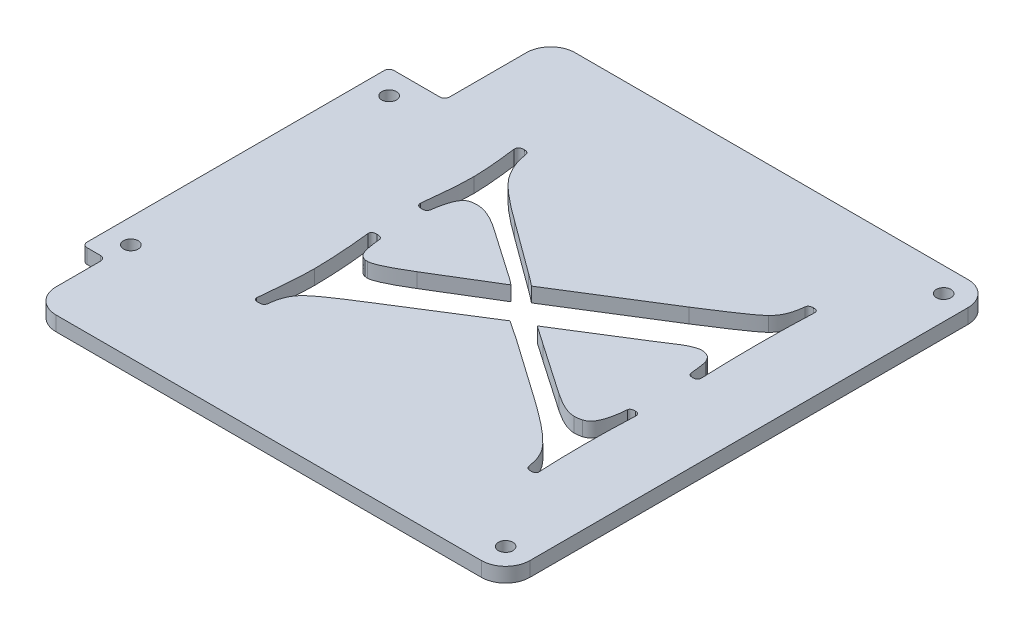
from build123d import *

# Parameters (mm, degrees)
BOSS_EXTRUDE1_DEPTH = 3
FILLET3_R           = 5
FILLET2_R           = 1
SKETCH2_R           = 1.5
CUT_EXTRUDE1_DEPTH  = 3
CUT_EXTRUDE2_DEPTH  = 3


with BuildPart() as part:
    # Sketch1 → Boss-Extrude1 (new body)
    with BuildSketch(Plane(origin=(0, 23, 0), x_dir=(1, 0, 0), z_dir=(0, 1, 0))):
        Polygon((98.305417602, 50), (98.305417602, 28.219474586), (86.879951937, 28.219474586), (86.879951937, -34.842217343), (91.659783805, -34.842217343), (91.659783805, -50), (97.650210801, -50), (189.045787513, -50), (189.045787513, 50), align=None)
    extrude(amount=BOSS_EXTRUDE1_DEPTH)

    # Fillet3
    fillet3_edges = [part.edges().sort_by_distance(p)[0] for p in [
        (189.045787513, 24.5, 50),
        (91.659783805, 24.5, 50),
        (98.305417602, 24.5, -50),
        (189.045787513, 24.5, -50),
    ]]
    fillet(fillet3_edges, radius=FILLET3_R)

    # Fillet2
    fillet2_edges = [part.edges().sort_by_distance(p)[0] for p in [
        (91.659783805, 24.5, 34.842217343),
        (86.879951937, 24.5, 34.842217343),
        (86.879951937, 24.5, -28.219474586),
        (98.305417602, 24.5, -28.219474586),
    ]]
    fillet(fillet2_edges, radius=FILLET2_R)

    # Sketch2 → Cut-Extrude1 (cut)
    with BuildSketch(Plane(origin=(0, 23, 0), x_dir=(1, 0, 0), z_dir=(0, 1, 0))):
        with Locations(Location((184.045787513, -45, 0), (0, 0, 90))):
            Circle(SKETCH2_R)
        with Locations(Location((91.879951937, -29.842217343, 0), (0, 0, 90))):
            Circle(SKETCH2_R)
        with Locations(Location((91.879951937, 23.219474586, 0), (0, 0, 90))):
            Circle(SKETCH2_R)
        with Locations(Location((184.045787513, 45, 0), (0, 0, 90))):
            Circle(SKETCH2_R)
    extrude(amount=CUT_EXTRUDE1_DEPTH, mode=Mode.SUBTRACT)

    # Sketch4 → Cut-Extrude2 (cut)
    with BuildSketch(Plane(origin=(0, 23, 0), x_dir=(1, 0, 0), z_dir=(0, 1, 0))):
        with BuildLine():
            Line((144.351606199, -4.405002967), (127.464586968, -15.042022198))
            add(Edge.make_bspline(
                [(127.464586968, -15.042022198), (126.898195291, -15.392246735), (125.816649312, -16.061013517), (124.298008902, -17.050886016), (122.928570135, -17.937550274), (121.736460133, -18.755591493), (120.693040345, -19.471486976), (119.829981473, -20.120669627), (119.12574917, -20.683215798), (118.725159512, -21.045947399), (118.546317738, -21.207887583)],
                knots=[0, 0, 0, 0, 1.472320828, 2.811451392, 4.007980441, 5.079214572, 6.008113963, 6.805362668, 7.466658574, 8, 8, 8, 8], degree=3))
            add(Edge.make_bspline(
                [(118.546317738, -21.207887583), (118.263268852, -21.52191014), (117.683869123, -22.164712831), (117.069628337, -23.367577881), (116.612007961, -24.745013365), (116.485430713, -25.743352665), (116.418913892, -26.267983736)],
                knots=[0, 0, 0, 0, 0.902760983, 1.847947461, 2.869088265, 4, 4, 4, 4], degree=3))
            add(Edge.make_bspline(
                [(116.418913892, -26.267983736), (116.387940503, -26.380485447), (116.328812035, -26.595252187), (116.080845919, -26.857180094), (115.710546665, -26.9748707), (115.437845471, -26.991879637), (115.289106199, -27.001156813)],
                knots=[0, 0, 0, 0, 0.934842855, 1.784623105, 2.791668119, 4, 4, 4, 4], degree=3))
            add(Edge.make_bspline(
                [(115.289106199, -27.001156813), (115.130908357, -26.999292557), (114.851041741, -26.995994514), (114.501215815, -26.864071662), (114.242986627, -26.653061509), (114.219472959, -26.454352171), (114.20737543, -26.352118352)],
                knots=[0, 0, 0, 0, 1.334053444, 2.360063937, 3.15627052, 4, 4, 4, 4], degree=3))
            add(Edge.make_bspline(
                [(114.20737543, -26.352118352), (114.268178243, -25.731192556), (114.385045957, -24.537725092), (114.542697081, -22.811043643), (114.674899579, -21.216431706), (114.783146686, -19.754038379), (114.868719382, -18.427912295), (114.929513254, -17.23393227), (114.96811794, -16.172085521), (114.97391698, -15.506792147), (114.976606199, -15.198272198)],
                knots=[0, 0, 0, 0, 1.338835045, 2.573344634, 3.720713761, 4.772456593, 5.720092408, 6.572327828, 7.337938175, 8, 8, 8, 8], degree=3))
            add(Edge.make_bspline(
                [(114.976606199, -15.198272198), (114.966353935, -14.352743878), (114.944718967, -12.568457125), (114.788786135, -9.755087799), (114.550052177, -6.665181967), (114.324888908, -4.516691888), (114.20737543, -3.395387583)],
                knots=[0, 0, 0, 0, 0.857425488, 1.8093929, 2.856714678, 4, 4, 4, 4], degree=3))
            add(Edge.make_bspline(
                [(114.20737543, -3.395387583), (114.219504891, -3.282548355), (114.242815012, -3.065696499), (114.485943912, -2.807073443), (114.858043405, -2.682888604), (115.139907847, -2.669736878), (115.30112543, -2.662214506)],
                knots=[0, 0, 0, 0, 0.896287379, 1.722464648, 2.697321511, 4, 4, 4, 4], degree=3))
            add(Edge.make_bspline(
                [(115.30112543, -2.662214506), (115.454724646, -2.666597614), (115.726836384, -2.674362596), (116.076824294, -2.781865744), (116.347574841, -2.95469515), (116.411314659, -3.136752797), (116.442952353, -3.227118352)],
                knots=[0, 0, 0, 0, 1.332929307, 2.361377367, 3.186658482, 4, 4, 4, 4], degree=3))
            add(Edge.make_bspline(
                [(116.442952353, -3.227118352), (116.497916769, -3.671982018), (116.597069328, -4.474489789), (116.745095088, -5.551059507), (116.903778138, -6.367065066), (117.037474033, -6.817488836), (117.091990815, -7.001156813)],
                knots=[0, 0, 0, 0, 1.402649067, 2.530296048, 3.400703139, 4, 4, 4, 4], degree=3))
            add(Edge.make_bspline(
                [(117.091990815, -7.001156813), (117.163574771, -7.178202401), (117.300694232, -7.517334195), (117.637220309, -7.934591169), (118.043428733, -8.253438433), (118.36170506, -8.363764981), (118.522279276, -8.419426044)],
                knots=[0, 0, 0, 0, 1.087727893, 2.083548742, 3.033127403, 4, 4, 4, 4], degree=3))
            add(Edge.make_bspline(
                [(118.522279276, -8.419426044), (118.630304172, -8.43344845), (118.845766867, -8.461417053), (119.062998086, -8.465478018), (119.171317738, -8.467502967)],
                knots=[0, 0, 0, 0, 1.002724816, 2, 2, 2, 2], degree=3))
            add(Edge.make_bspline(
                [(119.171317738, -8.467502967), (119.316448598, -8.45638107), (119.653109081, -8.430581573), (120.204532816, -8.250909029), (120.88139693, -8.002753917), (121.669593013, -7.626516985), (122.602749101, -7.193065113), (123.639286004, -6.616881611), (124.806837448, -5.958831664), (125.618620375, -5.476455961), (126.046317738, -5.222310659)],
                knots=[0, 0, 0, 0, 0.455388663, 1.056366421, 1.80829184, 2.719763092, 3.793795105, 5.036993135, 6.438905055, 8, 8, 8, 8], degree=3))
            Line((126.046317738, -5.222310659), (138.053529276, 2.085381648))
            add(Edge.make_bspline(
                [(138.053529276, 2.085381648), (137.625539491, 2.428371758), (136.709075245, 3.162824268), (135.727924095, 3.808529268), (135.204971584, 4.152689341)],
                knots=[0, 0, 0, 0, 0.934002144, 2, 2, 2, 2], degree=3))
            Line((135.204971584, 4.152689341), (125.721798507, 10.727208571))
            add(Edge.make_bspline(
                [(125.721798507, 10.727208571), (125.210941024, 11.050460946), (124.260516269, 11.651855797), (122.85079505, 12.333795342), (121.580650763, 12.770656194), (120.768488483, 12.836525319), (120.397279276, 12.866631648)],
                knots=[0, 0, 0, 0, 1.247971206, 2.321787911, 3.232951599, 4, 4, 4, 4], degree=3))
            add(Edge.make_bspline(
                [(120.397279276, 12.866631648), (120.168294528, 12.860419876), (119.687368419, 12.847373578), (119.214638474, 12.75747602), (118.966990815, 12.710381648)],
                knots=[0, 0, 0, 0, 0.952265823, 2, 2, 2, 2], degree=3))
            add(Edge.make_bspline(
                [(118.966990815, 12.710381648), (118.814875446, 12.64937105), (118.495315611, 12.521201642), (118.068424889, 12.167626018), (117.697698582, 11.674411308), (117.376577481, 11.043719136), (117.079856792, 10.286993292), (116.815115154, 9.391108691), (116.605859048, 8.35647488), (116.499220799, 7.618833988), (116.442952353, 7.229612417)],
                knots=[0, 0, 0, 0, 0.620651059, 1.303846888, 2.075212062, 2.954796131, 3.987916046, 5.164650224, 6.50390711, 8, 8, 8, 8], degree=3))
            add(Edge.make_bspline(
                [(116.442952353, 7.229612417), (116.416940226, 7.112745653), (116.367130285, 6.888960539), (116.125303524, 6.629167127), (115.784814478, 6.478578705), (115.527305163, 6.466850862), (115.385260045, 6.460381648)],
                knots=[0, 0, 0, 0, 0.978881351, 1.874434332, 2.82751339, 4, 4, 4, 4], degree=3))
            add(Edge.make_bspline(
                [(115.385260045, 6.460381648), (115.210395971, 6.463299781), (114.901482009, 6.468454939), (114.508332777, 6.645053538), (114.236087746, 6.934658897), (114.217206325, 7.183949923), (114.20737543, 7.313747033)],
                knots=[0, 0, 0, 0, 1.261486588, 2.228535625, 3.07766052, 4, 4, 4, 4], degree=3))
            add(Edge.make_bspline(
                [(114.20737543, 7.313747033), (114.268416816, 7.854508859), (114.386829326, 8.903517889), (114.543843905, 10.433970874), (114.675208596, 11.86842069), (114.784687163, 13.206542418), (114.869564266, 14.444607976), (114.929969489, 15.586548033), (114.968683047, 16.632388141), (114.974051853, 17.297692402), (114.976606199, 17.614227802)],
                knots=[0, 0, 0, 0, 1.263852355, 2.451712507, 3.572946922, 4.609147954, 5.569733427, 6.454894785, 7.264876952, 8, 8, 8, 8], degree=3))
            add(Edge.make_bspline(
                [(114.976606199, 17.614227802), (114.974003298, 17.874678434), (114.968475016, 18.427847421), (114.929540125, 19.305427434), (114.869074048, 20.279095234), (114.784140053, 21.34888522), (114.674500217, 22.518702864), (114.543441584, 23.784925284), (114.385299658, 25.150965033), (114.268196519, 26.091880692), (114.20737543, 26.580573956)],
                knots=[0, 0, 0, 0, 0.69420381, 1.474413845, 2.34104263, 3.294390515, 4.334682741, 5.472713655, 6.687376705, 8, 8, 8, 8], degree=3))
            add(Edge.make_bspline(
                [(114.20737543, 26.580573956), (114.217577606, 26.721020585), (114.237058609, 26.989202725), (114.493672996, 27.322573749), (114.904183999, 27.494156335), (115.211256703, 27.509423045), (115.385260045, 27.518073956)],
                knots=[0, 0, 0, 0, 0.970347507, 1.852873742, 2.783326749, 4, 4, 4, 4], degree=3))
            add(Edge.make_bspline(
                [(115.385260045, 27.518073956), (115.526951308, 27.507387883), (115.790530005, 27.487509301), (116.153040554, 27.316869106), (116.368105009, 26.978814056), (116.409007813, 26.719548958), (116.430933122, 26.580573956)],
                knots=[0, 0, 0, 0, 1.080128821, 2.009290766, 2.932911441, 4, 4, 4, 4], degree=3))
            add(Edge.make_bspline(
                [(116.430933122, 26.580573956), (116.516348907, 26.08799141), (116.691362911, 25.078706715), (117.249960375, 23.58987962), (118.002945616, 22.073780289), (118.669367281, 21.115918163), (119.015067738, 20.619035494)],
                knots=[0, 0, 0, 0, 0.912299322, 1.869269932, 2.894702262, 4, 4, 4, 4], degree=3))
            add(Edge.make_bspline(
                [(119.015067738, 20.619035494), (119.192546105, 20.408141742), (119.572599716, 19.956532155), (120.248788208, 19.284099273), (121.034141778, 18.541873374), (121.959064876, 17.748043668), (123.001703526, 16.882553452), (124.17634726, 15.961198449), (125.481767215, 14.989096948), (126.390522782, 14.32048406), (126.86362543, 13.972400879)],
                knots=[0, 0, 0, 0, 0.641462297, 1.373632554, 2.218314875, 3.157246719, 4.210645128, 5.373201843, 6.632475872, 8, 8, 8, 8], degree=3))
            Line((126.86362543, 13.972400879), (137.656894661, 6.051727802))
            add(Edge.make_bspline(
                [(137.656894661, 6.051727802), (138.088794504, 5.743444252), (139.012780403, 5.083917146), (139.892637272, 4.366496146), (140.361221584, 3.98442011)],
                knots=[0, 0, 0, 0, 0.934862412, 2, 2, 2, 2], degree=3))
            Line((140.361221584, 3.98442011), (160.289106199, 16.436343187))
            add(Edge.make_bspline(
                [(160.289106199, 16.436343187), (160.938640397, 16.852246648), (162.171218805, 17.641479346), (163.912766037, 18.773176707), (165.455139669, 19.775082238), (166.770331705, 20.678996589), (167.881094102, 21.445268828), (168.777850636, 22.094547837), (169.461362995, 22.630622941), (169.841251607, 22.957744074), (170.000644661, 23.094997033)],
                knots=[0, 0, 0, 0, 1.570948896, 2.981086596, 4.230448196, 5.316880004, 6.231423087, 6.978976257, 7.571600499, 8, 8, 8, 8], degree=3))
            add(Edge.make_bspline(
                [(170.000644661, 23.094997033), (170.291905749, 23.429099085), (170.884472926, 24.108825688), (171.518260826, 25.364560381), (171.967816943, 26.798429222), (172.096693244, 27.831209773), (172.164106199, 28.371439341)],
                knots=[0, 0, 0, 0, 0.911944529, 1.855340164, 2.87816569, 4, 4, 4, 4], degree=3))
            add(Edge.make_bspline(
                [(172.164106199, 28.371439341), (172.186816503, 28.479616779), (172.230811323, 28.689180106), (172.462492429, 28.94454591), (172.81099076, 29.067591071), (173.068745295, 29.083751037), (173.209779276, 29.092593187)],
                knots=[0, 0, 0, 0, 0.92937462, 1.800401638, 2.79645914, 4, 4, 4, 4], degree=3))
            add(Edge.make_bspline(
                [(173.209779276, 29.092593187), (173.35513711, 29.084747589), (173.613787319, 29.070787107), (173.95728722, 28.943800376), (174.181921037, 28.68939339), (174.198712094, 28.479654173), (174.20737543, 28.371439341)],
                knots=[0, 0, 0, 0, 1.251514999, 2.226949926, 3.085195799, 4, 4, 4, 4], degree=3))
            add(Edge.make_bspline(
                [(174.20737543, 28.371439341), (174.137266764, 26.488640924), (173.998870138, 22.771939943), (173.977523646, 19.052732497), (173.966990815, 17.217593187)],
                knots=[0, 0, 0, 0, 1.013155713, 2, 2, 2, 2], degree=3))
            add(Edge.make_bspline(
                [(173.966990815, 17.217593187), (173.967948158, 16.147853356), (173.969823509, 14.052327372), (174.024125396, 10.975395797), (174.088485798, 8.026167011), (174.168294019, 6.103713808), (174.20737543, 5.162304725)],
                knots=[0, 0, 0, 0, 1.064517092, 2.0852951, 3.062385195, 4, 4, 4, 4], degree=3))
            add(Edge.make_bspline(
                [(174.20737543, 5.162304725), (174.19937171, 5.023524385), (174.184776507, 4.770451143), (173.986765955, 4.435734937), (173.635842388, 4.26560836), (173.375614145, 4.246976381), (173.233817738, 4.236823956)],
                knots=[0, 0, 0, 0, 1.077694319, 1.965232209, 2.891270377, 4, 4, 4, 4], degree=3))
            add(Edge.make_bspline(
                [(173.233817738, 4.236823956), (173.096204774, 4.244489073), (172.848801261, 4.258269583), (172.518044642, 4.392407183), (172.290732245, 4.63976824), (172.246852998, 4.849640758), (172.224202353, 4.957977802)],
                knots=[0, 0, 0, 0, 1.198628502, 2.154919811, 3.047562131, 4, 4, 4, 4], degree=3))
            add(Edge.make_bspline(
                [(172.224202353, 4.957977802), (172.186630509, 5.366931637), (172.118001871, 6.113925713), (171.991293747, 7.121354648), (171.848706279, 7.908193033), (171.706897879, 8.344330089), (171.647279276, 8.527689341)],
                knots=[0, 0, 0, 0, 1.359375823, 2.483032554, 3.362241729, 4, 4, 4, 4], degree=3))
            add(Edge.make_bspline(
                [(171.647279276, 8.527689341), (171.569645335, 8.695739423), (171.421208452, 9.017052885), (171.100169091, 9.425821246), (170.711248321, 9.740534172), (170.405408114, 9.853583429), (170.253048507, 9.909900879)],
                knots=[0, 0, 0, 0, 1.090324143, 2.084710812, 3.045865452, 4, 4, 4, 4], degree=3))
            add(Edge.make_bspline(
                [(170.253048507, 9.909900879), (170.0982278, 9.962015773), (169.793959753, 10.064436807), (169.473130308, 10.073646557), (169.315548507, 10.07817011)],
                knots=[0, 0, 0, 0, 1.017659983, 2, 2, 2, 2], degree=3))
            add(Edge.make_bspline(
                [(169.315548507, 10.07817011), (169.105845291, 10.061561831), (168.641348147, 10.024774135), (167.913711186, 9.78543657), (167.08190412, 9.434566033), (166.519674811, 9.111598262), (166.214586968, 8.936343187)],
                knots=[0, 0, 0, 0, 0.754303268, 1.670797996, 2.736082945, 4, 4, 4, 4], degree=3))
            add(Edge.make_bspline(
                [(166.214586968, 8.936343187), (166.157981288, 8.90512432), (166.012773704, 8.825040196), (165.769094105, 8.650851989), (165.425106061, 8.435902647), (164.989758554, 8.159512534), (164.468336614, 7.807514874), (163.84035761, 7.417701763), (163.132625189, 6.958764641), (162.632776509, 6.632778424), (162.368433122, 6.460381648)],
                knots=[0, 0, 0, 0, 0.338924079, 0.869424174, 1.569081894, 2.467021618, 3.574674522, 4.869189774, 6.344280959, 8, 8, 8, 8], degree=3))
            Line((162.368433122, 6.460381648), (148.053529276, -2.505964506))
            add(Edge.make_bspline(
                [(148.053529276, -2.505964506), (148.302620465, -2.66919637), (148.852885509, -3.029790373), (149.730638318, -3.64033589), (150.747430067, -4.354657877), (151.467217402, -4.86541557), (151.851606199, -5.138176044)],
                knots=[0, 0, 0, 0, 0.773275811, 1.708236445, 2.77612707, 4, 4, 4, 4], degree=3))
            Line((151.851606199, -5.138176044), (162.368433122, -12.361733736))
            add(Edge.make_bspline(
                [(162.368433122, -12.361733736), (162.655843278, -12.551690793), (163.205816925, -12.915183082), (164.016291182, -13.41357692), (164.77900913, -13.838873723), (165.505221063, -14.165173433), (166.163534846, -14.4638541), (166.794987985, -14.630385225), (167.370484935, -14.76950977), (167.744300731, -14.783156208), (167.921317738, -14.789618352)],
                knots=[0, 0, 0, 0, 1.347273761, 2.578075442, 3.721064646, 4.758547125, 5.692670437, 6.54068866, 7.308956635, 8, 8, 8, 8], degree=3))
            add(Edge.make_bspline(
                [(167.921317738, -14.789618352), (168.154543405, -14.780111116), (168.661559171, -14.759443072), (169.156468824, -14.646357819), (169.423721584, -14.585291429)],
                knots=[0, 0, 0, 0, 0.91999375, 2, 2, 2, 2], degree=3))
            add(Edge.make_bspline(
                [(169.423721584, -14.585291429), (169.613482558, -14.51952393), (170.001545732, -14.38502871), (170.506337338, -13.96726778), (170.959962679, -13.403757767), (171.312783132, -12.655407087), (171.646667432, -11.766061833), (171.898913233, -10.703560346), (172.102250763, -9.478669158), (172.182067776, -8.604466368), (172.224202353, -8.142983736)],
                knots=[0, 0, 0, 0, 0.645506943, 1.32006844, 2.08573434, 2.973204213, 3.98269544, 5.159176813, 6.500358757, 8, 8, 8, 8], degree=3))
            add(Edge.make_bspline(
                [(172.224202353, -8.142983736), (172.246794572, -8.052619898), (172.292312084, -7.870560003), (172.554038322, -7.697597172), (172.891667069, -7.589987506), (173.156199486, -7.582383817), (173.305933122, -7.57807989)],
                knots=[0, 0, 0, 0, 0.810849161, 1.633652517, 2.660573178, 4, 4, 4, 4], degree=3))
            add(Edge.make_bspline(
                [(173.305933122, -7.57807989), (173.44066038, -7.586804218), (173.684075708, -7.602566695), (174.003659681, -7.787347656), (174.18208814, -8.114690478), (174.19837161, -8.36509912), (174.20737543, -8.503560659)],
                knots=[0, 0, 0, 0, 1.090267451, 1.969815268, 2.877424912, 4, 4, 4, 4], degree=3))
            add(Edge.make_bspline(
                [(174.20737543, -8.503560659), (174.168257463, -9.300720126), (174.087884553, -10.938587084), (174.023488797, -13.475262448), (173.969799079, -16.155573718), (173.967941694, -17.994714193), (173.966990815, -18.936252967)],
                knots=[0, 0, 0, 0, 0.917642433, 1.885414754, 2.917448651, 4, 4, 4, 4], degree=3))
            add(Edge.make_bspline(
                [(173.966990815, -18.936252967), (173.976339114, -20.531079435), (173.994736513, -23.669688694), (174.137268464, -26.805100564), (174.20737543, -28.347310659)],
                knots=[0, 0, 0, 0, 1.016263152, 2, 2, 2, 2], degree=3))
            add(Edge.make_bspline(
                [(174.20737543, -28.347310659), (174.199701118, -28.449218952), (174.18494348, -28.645187741), (173.942157943, -28.856444346), (173.613002928, -28.992407913), (173.348182606, -28.994921411), (173.197760045, -28.996349121)],
                knots=[0, 0, 0, 0, 0.87169135, 1.676255137, 2.680072402, 4, 4, 4, 4], degree=3))
            add(Edge.make_bspline(
                [(173.197760045, -28.996349121), (173.05583823, -28.99339545), (172.796128418, -28.987990381), (172.465347514, -28.856473725), (172.215641472, -28.645170348), (172.173831348, -28.449219631), (172.152086968, -28.347310659)],
                knots=[0, 0, 0, 0, 1.244289692, 2.276987812, 3.103905296, 4, 4, 4, 4], degree=3))
            add(Edge.make_bspline(
                [(172.152086968, -28.347310659), (172.065557832, -27.822045463), (171.896832079, -26.797815138), (171.348008496, -25.353206673), (170.593260953, -24.031922411), (169.918933195, -23.280375947), (169.579971584, -22.902599121)],
                knots=[0, 0, 0, 0, 1.039972447, 2.027873397, 3.008679084, 4, 4, 4, 4], degree=3))
            add(Edge.make_bspline(
                [(169.579971584, -22.902599121), (169.357039145, -22.676784401), (168.883181364, -22.196800141), (168.097285757, -21.463394298), (167.198178747, -20.670530128), (166.170760354, -19.831398828), (165.033635073, -18.932711021), (163.777516569, -17.981578444), (162.407448647, -16.97152959), (161.447913701, -16.286696208), (160.950163892, -15.931445275)],
                knots=[0, 0, 0, 0, 0.68550637, 1.457089547, 2.321849357, 3.274973221, 4.322649913, 5.453121873, 6.678830712, 8, 8, 8, 8], degree=3))
            Line((160.950163892, -15.931445275), (148.522279276, -7.205483736))
            add(Edge.make_bspline(
                [(148.522279276, -7.205483736), (148.226304076, -7.000424417), (147.600588239, -6.566912205), (146.603528429, -5.898916067), (145.513796458, -5.163691781), (144.748930948, -4.664380328), (144.351606199, -4.405002967)],
                knots=[0, 0, 0, 0, 0.86005721, 1.818231448, 2.866636514, 4, 4, 4, 4], degree=3))
        make_face()
    extrude(amount=CUT_EXTRUDE2_DEPTH, mode=Mode.SUBTRACT)


solid = part.part
